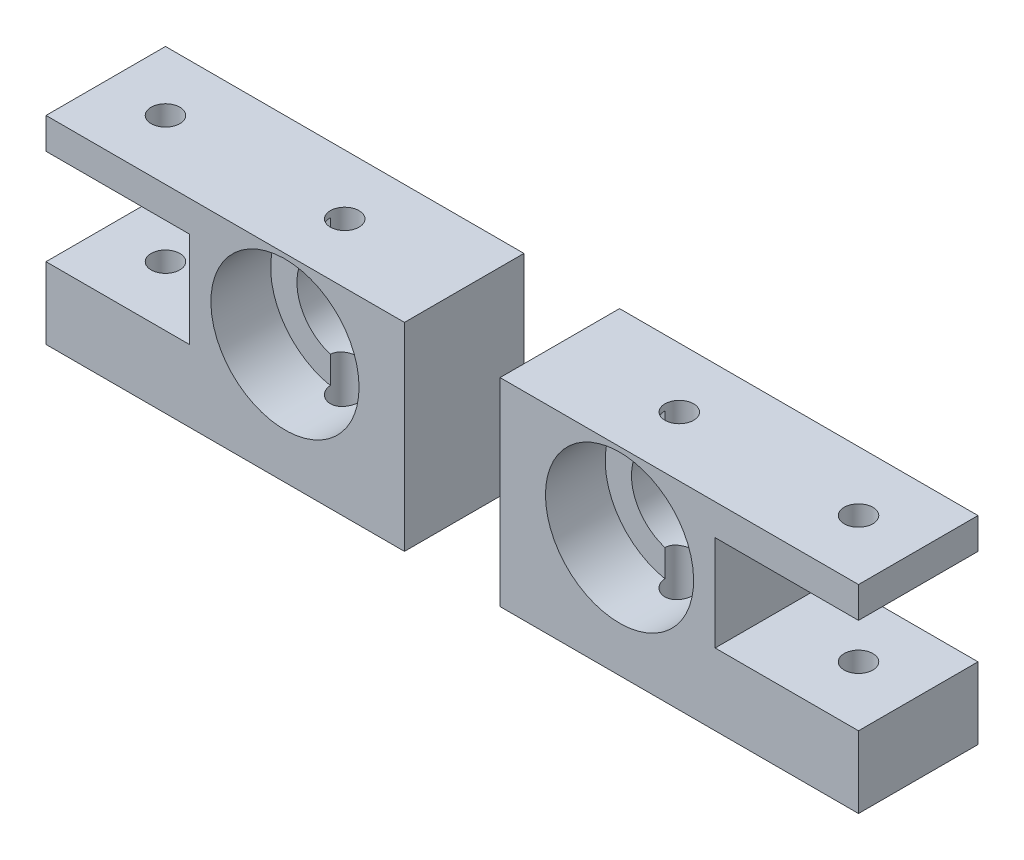
from build123d import *

# Parameters (mm, degrees)
SKETCH_1_W          = 20
SKETCH_1_H          = 10
SKETCH_1_R          = 3.1
EXTRUDE_1_DEPTH     = 2.5
SKETCH_2_W          = 20
SKETCH_2_H          = 10
EXTRUDE_2_DEPTH     = 2.5
SKETCH_3_R          = 0.6
CUT_EXTRUDE_1_DEPTH = 15.361406616
SKETCH_4_W          = 6
SKETCH_4_H          = 4
CUT_EXTRUDE_2_DEPTH = 13.247448796
SKETCH_5_R          = 2
CUT_EXTRUDE_3_DEPTH = 13.247448755
SKETCH_6_W          = 20
SKETCH_6_H          = 1.7
CUT_EXTRUDE_4_DEPTH = 13.247448796
SKETCH_7_W          = 5
SKETCH_7_H          = 8.3
CUT_EXTRUDE_5_DEPTH = 13.247448796


with BuildPart() as part:
    # 草图1 → 凸台-拉伸1 (new body)
    with BuildSketch(Plane.XY):
        Rectangle(SKETCH_1_W, SKETCH_1_H)
        Circle(SKETCH_1_R, mode=Mode.SUBTRACT)
    extrude(amount=EXTRUDE_1_DEPTH)

    # 草图2 → 凸台-拉伸2 (add)
    with BuildSketch(Plane(origin=(0, 0, 0), x_dir=(-1, 0, 0), z_dir=(0, 0, -1))):
        Rectangle(SKETCH_2_W, SKETCH_2_H)
    extrude(amount=EXTRUDE_2_DEPTH)

    # 草图3 → 切除-拉伸1 (cut, through all)
    with BuildSketch(Plane.XZ.offset(5)):
        with Locations((-7.5, 0)):
            Circle(SKETCH_3_R)
        Circle(SKETCH_3_R)
    extrude(amount=-CUT_EXTRUDE_1_DEPTH, mode=Mode.SUBTRACT)

    # 草图4 → 切除-拉伸2 (cut, through all)
    with BuildSketch(Plane(origin=(0, 0, -2.5), x_dir=(-1, 0, 0), z_dir=(0, 0, -1))):
        with Locations((7, 0)):
            Rectangle(SKETCH_4_W, SKETCH_4_H)
    extrude(amount=-CUT_EXTRUDE_2_DEPTH, mode=Mode.SUBTRACT)

    # 草图5 → 切除-拉伸3 (cut, through all)
    with BuildSketch(Plane.XY.offset(2.5)):
        Circle(SKETCH_5_R)
    extrude(amount=-CUT_EXTRUDE_3_DEPTH, mode=Mode.SUBTRACT)

    # 草图6 → 切除-拉伸4 (cut, through all)
    with BuildSketch(Plane.XY.offset(2.5)):
        with Locations((0, 4.15)):
            Rectangle(SKETCH_6_W, SKETCH_6_H)
    extrude(amount=-CUT_EXTRUDE_4_DEPTH, mode=Mode.SUBTRACT)

    # 草图7 → 切除-拉伸5 (cut, through all)
    with BuildSketch(Plane.XY.offset(2.5)):
        with Locations((7.5, -0.85)):
            Rectangle(SKETCH_7_W, SKETCH_7_H)
    extrude(amount=-CUT_EXTRUDE_5_DEPTH, mode=Mode.SUBTRACT)


with BuildPart() as body_2:
    # 镜向2: mirrored copy
    add(part.part.mirror(Plane(origin=(7, 0, 0), x_dir=(0, 0, 1), z_dir=(1, 0, 0))))


solid = Compound([part.part, body_2.part])
